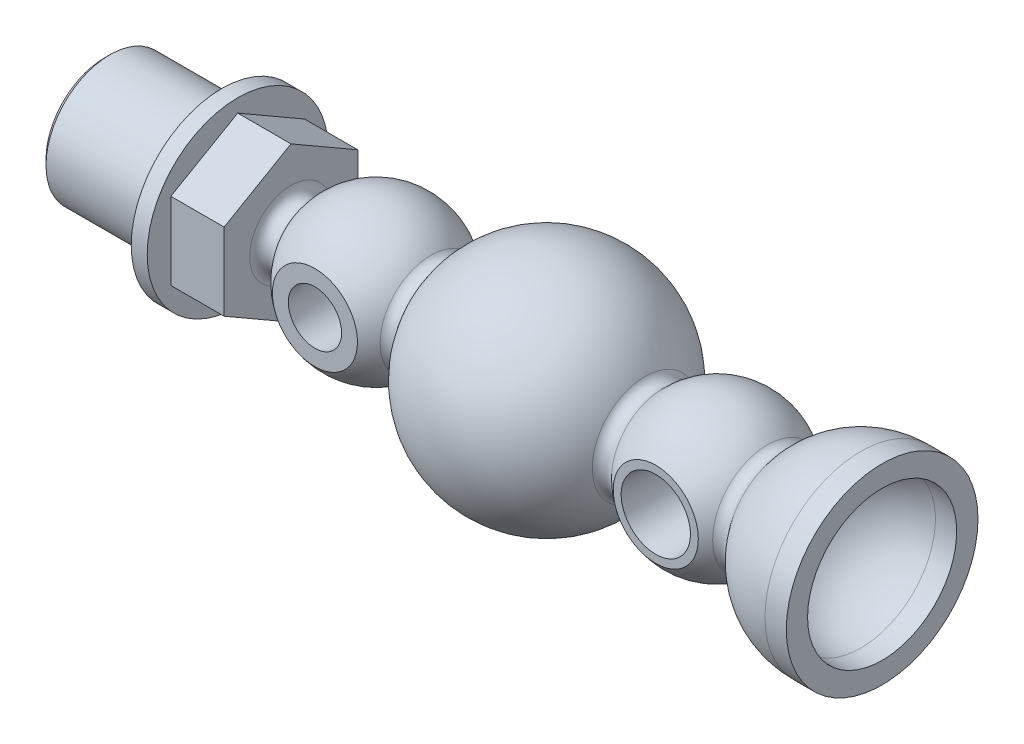
from build123d import *
from build123d.topology import SkipClean

# Parameters (mm, degrees)
CUT_EXTRUDE3_DEPTH = 177.306551211
CUT_EXTRUDE4_DEPTH = 177.306551211
SKETCH5_OUTSIDE_W  = 149.048
SKETCH5_OUTSIDE_H  = 149.048
CUT_EXTRUDE5_DEPTH = 20


with BuildPart() as part:
    # Sketch2 → Revolve1 (revolve)
    with BuildSketch(Plane(origin=(0, 0, 0), x_dir=(1, 0, 0), z_dir=(0, 1, 0)), mode=Mode.PRIVATE) as revolve1_sk:
        with BuildLine():
            Line((-166, 12), (-98, 12))
            ThreePointArc((-98, 12), (-96.585786438, 11.414213562), (-96, 10))
            Line((-96, 10), (-96, 5))
            Line((-96, 5), (-36.331804249, 5))
            ThreePointArc((-36.331804249, 5), (-35.058375169, 5.457800798), (-34.367922938, 6.621621622))
            ThreePointArc((-34.367922938, 6.621621622), (0, 35), (34.367922938, 6.621621622))
            ThreePointArc((34.367922938, 6.621621622), (35.058375169, 5.457800798), (36.331804249, 5))
            Line((36.331804249, 5), (88.828095708, 5))
            ThreePointArc((88.828095708, 5), (90.066374083, 5.429437468), (90.772889328, 6.533333333))
            ThreePointArc((90.772889328, 6.533333333), (100.664102754, 21.987875447), (118, 28))
            Line((118, 28), (126, 28))
            Line((126, 28), (126, 36))
            Line((126, 36), (118, 36))
            ThreePointArc((118, 36), (101.674984017, 32.085726627), (88.9, 21.194102953))
            ThreePointArc((88.9, 21.194102953), (86.061071986, 19.568495218), (82.958333333, 20.605377871))
            ThreePointArc((82.958333333, 20.605377871), (62.887072933, 27.977873281), (43.46484375, 19.03437306))
            ThreePointArc((43.46484375, 19.03437306), (40.022818625, 17.786013599), (37.006793478, 19.861954497))
            ThreePointArc((37.006793478, 19.861954497), (0, 42), (-37.006793478, 19.861954497))
            ThreePointArc((-37.006793478, 19.861954497), (-40.022818625, 17.786013599), (-43.46484375, 19.03437306))
            ThreePointArc((-43.46484375, 19.03437306), (-67.381518693, 27.795059477), (-88.5, 13.555441712))
            ThreePointArc((-88.5, 13.555441712), (-93, 11.618950039), (-96, 15.491933385))
            Line((-96, 15.491933385), (-96, 29))
            Line((-96, 29), (-116, 29))
            Line((-116, 29), (-116, 34))
            Line((-116, 34), (-122, 34))
            Line((-122, 34), (-122, 22))
            Line((-122, 22), (-124, 22))
            Line((-124, 22), (-124, 24))
            Line((-124, 24), (-164, 24))
            Line((-164, 24), (-166, 22))
            Line((-166, 22), (-166, 12))
        make_face()
    revolve(revolve1_sk.sketch.rotate(Axis((-126, 0, 0), (1, 0, 0)), 180), axis=Axis((-126, 0, 0), (1, 0, 0)))

    # Sketch2<3> → Cut-Extrude3 (cut, symmetric)
    with SkipClean():  # the faces are left unmerged after this step: merging them gives an invalid solid
        with BuildSketch(Plane(origin=(0, 0, 0), x_dir=(1, 0, 0), z_dir=(0, 1, 0))):
            with BuildLine():
                ThreePointArc((-48.031280577, 23), (-64, 28), (-79.968719423, 23))
                Line((-79.968719423, 23), (-48.031280577, 23))
            make_face()
        cut_extrude3 = extrude(amount=CUT_EXTRUDE3_DEPTH, both=True, mode=Mode.SUBTRACT)

    # Sketch2<4> → Cut-Extrude4 (cut, symmetric)
    with SkipClean():  # the faces are left unmerged after this step: merging them gives an invalid solid
        with BuildSketch(Plane(origin=(0, 0, 0), x_dir=(1, 0, 0), z_dir=(0, 1, 0))):
            with BuildLine():
                Line((48.031280577, 23), (79.968719423, 23))
                ThreePointArc((79.968719423, 23), (64, 28), (48.031280577, 23))
            make_face()
        cut_extrude4 = extrude(amount=CUT_EXTRUDE4_DEPTH, both=True, mode=Mode.SUBTRACT)

    # Mirror1: Cut-Extrude3, Cut-Extrude4 across plane
    with SkipClean():  # the faces are left unmerged after this step: merging them gives an invalid solid
        add(cut_extrude3.mirror(Plane.XY), mode=Mode.SUBTRACT)
        add(cut_extrude4.mirror(Plane.XY), mode=Mode.SUBTRACT)

    # Sketch3 → Cut-Revolve1 (revolve, cut)
    with SkipClean():  # the faces are left unmerged after this step: merging them gives an invalid solid
        with BuildSketch(Plane(origin=(0, 0, 0), x_dir=(1, 0, 0), z_dir=(0, 1, 0)), mode=Mode.PRIVATE) as cut_revolve1_sk:
            Polygon((-77, 23), (-64, 23), (-64, -23), (-74, -23), align=None)
        revolve(cut_revolve1_sk.sketch.rotate(Axis((-64, 0, 23), (0, 0, -1)), 180), axis=Axis((-64, 0, 23), (0, 0, -1)), mode=Mode.SUBTRACT)

    # Sketch4 → Cut-Revolve2 (revolve, cut)
    with SkipClean():  # the faces are left unmerged after this step: merging them gives an invalid solid
        with BuildSketch(Plane(origin=(0, 0, 0), x_dir=(1, 0, 0), z_dir=(0, 1, 0)), mode=Mode.PRIVATE) as cut_revolve2_sk:
            Polygon((64, -23), (64, 23), (54, 23), (51, -23), align=None)
        revolve(cut_revolve2_sk.sketch.rotate(Axis((64, 0, 23), (0, 0, -1)), 180), axis=Axis((64, 0, 23), (0, 0, -1)), mode=Mode.SUBTRACT)

    # Sketch5 outside → Cut-Extrude5 (cut)
    with SkipClean():  # the faces are left unmerged after this step: merging them gives an invalid solid
        with BuildSketch(Plane(origin=(-96, 0, 0), x_dir=(0, 0, -1), z_dir=(1, 0, 0))):
            Rectangle(SKETCH5_OUTSIDE_W, SKETCH5_OUTSIDE_H)
            Polygon((25.11473671, 14.5), (0, 29), (-25.11473671, 14.5), (-25.11473671, -14.5), (0, -29), (25.11473671, -14.5), align=None, mode=Mode.SUBTRACT)
        extrude(amount=-CUT_EXTRUDE5_DEPTH, mode=Mode.SUBTRACT)


solid = part.part
